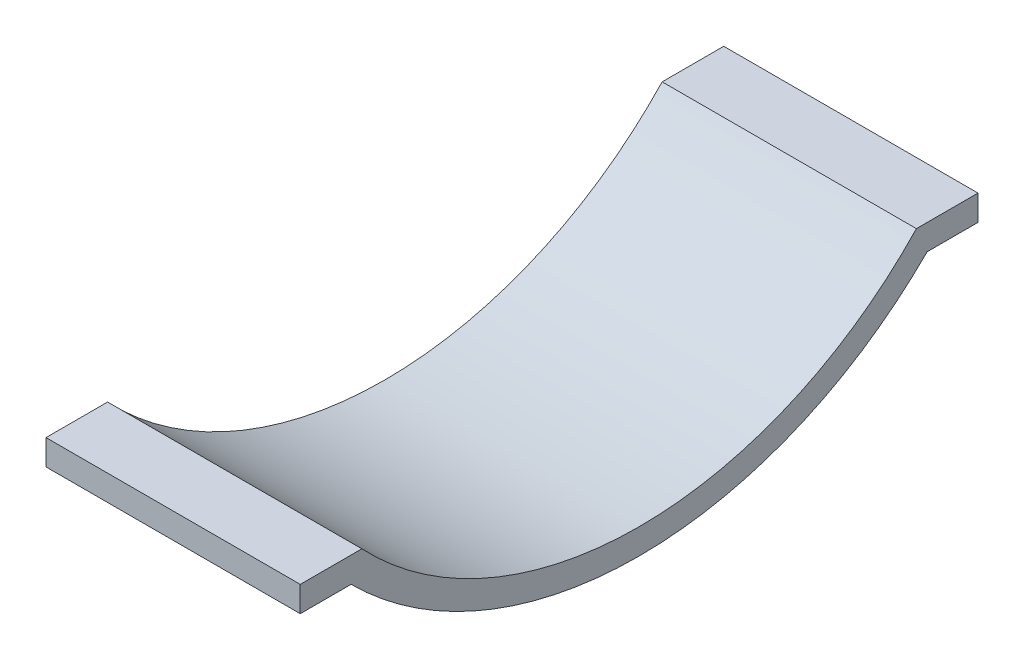
from build123d import *

# Parameters (mm, degrees)
BOSS_EXTRU_1_DEPTH = 10


with BuildPart() as part:
    # Esquisse1 → Boss.-Extru.1 (new body)
    with BuildSketch(Plane(origin=(0, 0, 0), x_dir=(0, 0, -1), z_dir=(1, 0, 0))):
        with BuildLine():
            Line((-89.898468063, -36.480057998), (-91.898468063, -36.480057998))
            Line((-91.898468063, -36.480057998), (-91.898468063, -35.480057998))
            Line((-91.898468063, -35.480057998), (-89.475592066, -35.480057998))
            ThreePointArc((-89.475592066, -35.480057998), (-78.569905432, -40.181223159), (-67.664218798, -35.480057998))
            Line((-67.664218798, -35.480057998), (-65.241342801, -35.480057998))
            Line((-65.241342801, -35.480057998), (-65.241342801, -36.480057998))
            Line((-65.241342801, -36.480057998), (-67.241342801, -36.480057998))
            ThreePointArc((-67.241342801, -36.480057998), (-78.569905432, -41.181223159), (-89.898468063, -36.480057998))
        make_face()
    extrude(amount=-BOSS_EXTRU_1_DEPTH)


solid = part.part
